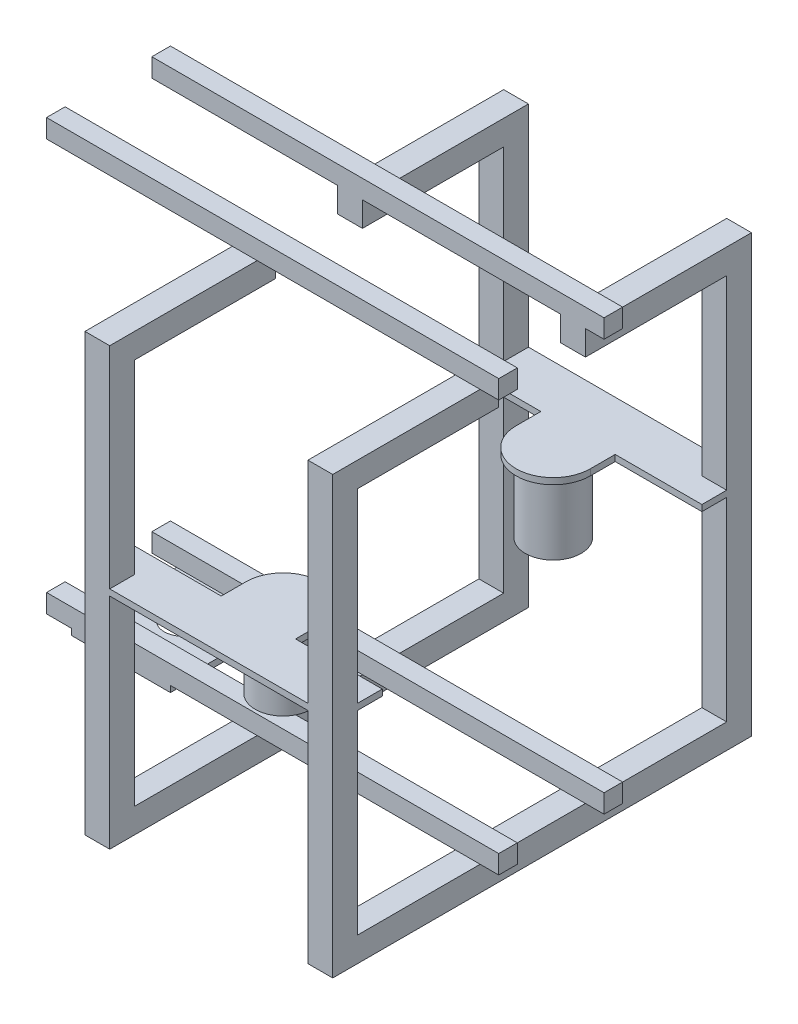
from build123d import *

# Parameters (mm, degrees)
SKETCH_1_W            = 20
SKETCH_1_H            = 338
EXTRUDE_1_DEPTH       = 20
EXTRUDE_1_2_DEPTH     = 20
SKETCH_2_W            = 20
SKETCH_2_H            = 20
EXTRUDE_2_DEPTH       = 157
EXTRUDE_4_DEPTH       = 5
SKETCH_6_R            = 22.5
EXTRUDE_5_DEPTH       = 58
EXTRUDE_6_DEPTH       = 15
EXTRUDE_6_DEPTH_BACK  = 350
SKETCH_7_W            = 15
SKETCH_7_H            = 15
SKETCH_12_W           = 20
SKETCH_12_H           = 20
EXTRUDE_10_DEPTH      = 150
SKETCH_13_W           = 20
SKETCH_13_H           = 20
EXTRUDE_11_DEPTH      = 134
SKETCH_14_W           = 20
SKETCH_14_H           = 20
EXTRUDE_12_DEPTH      = 134
EXTRUDE_13_DEPTH      = 15
EXTRUDE_13_DEPTH_BACK = 350
SKETCH_15_W           = 15
SKETCH_15_H           = 15
SKETCH_19_W           = 80
SKETCH_19_H           = 5
EXTRUDE_15_DEPTH      = 100
SKETCH_20_R           = 15
CUT_EXTRUDE_1_DEPTH   = 5


with BuildPart() as part:
    # 草图1 → 凸台-拉伸1 (new body)
    with BuildSketch(Plane(origin=(0, 0, 0), x_dir=(1, 0, 0), z_dir=(0, 1, 0))):
        with Locations((10, 169)):
            Rectangle(SKETCH_1_W, SKETCH_1_H)
    extrude(amount=EXTRUDE_1_DEPTH)



with BuildPart() as body_2:
    # 草图1 → Extrude 1 2 (new body)
    with BuildSketch(Plane(origin=(0, 0, 0), x_dir=(1, 0, 0), z_dir=(0, 1, 0))):
        with Locations((190, 169)):
            Rectangle(SKETCH_1_W, SKETCH_1_H)
    extrude(amount=EXTRUDE_1_2_DEPTH)


with BuildPart() as part_1:
    add(part.part)

    add(body_2.part)  # 凸台-拉伸2 merges body 2
    # 草图2 → 凸台-拉伸2 (add)
    with BuildSketch(Plane(origin=(0, 20, 0), x_dir=(1, 0, 0), z_dir=(0, 1, 0))):
        with Locations((10, 328)):
            Rectangle(SKETCH_2_W, SKETCH_2_H)
        with Locations((190, 328)):
            Rectangle(SKETCH_2_W, SKETCH_2_H)
        with Locations((190, 10)):
            Rectangle(SKETCH_2_W, SKETCH_2_H)
        with Locations((10, 10)):
            Rectangle(SKETCH_2_W, SKETCH_2_H)
    extrude(amount=EXTRUDE_2_DEPTH)

    # 草图5 → 凸台-拉伸4 (add)
    with BuildSketch(Plane(origin=(0, 177, 0), x_dir=(1, 0, 0), z_dir=(0, 1, 0))):
        with BuildLine():
            Line((0, 0), (200, 0))
            Line((200, 0), (200, 40))
            Line((200, 40), (130, 40))
            Line((130, 40), (130, 60))
            ThreePointArc((130, 60), (100, 90), (70, 60))
            Line((70, 60), (70, 40))
            Line((70, 40), (0, 40))
            Line((0, 40), (0, 0))
        make_face()
        with BuildLine():
            Line((0, 338), (200, 338))
            Line((200, 338), (200, 298))
            Line((200, 298), (130, 298))
            Line((130, 298), (130, 278))
            ThreePointArc((130, 278), (100, 248), (70, 278))
            Line((70, 278), (70, 298))
            Line((70, 298), (0, 298))
            Line((0, 298), (0, 338))
        make_face()
    extrude(amount=EXTRUDE_4_DEPTH)

    # 草图6 → 凸台-拉伸5 (add)
    with BuildSketch(Plane(origin=(0, 177, 0), x_dir=(-1, 0, 0), z_dir=(0, -1, 0))):
        with Locations((-100, 60)):
            Circle(SKETCH_6_R)
        with Locations((-100, 278)):
            Circle(SKETCH_6_R)
    extrude(amount=EXTRUDE_5_DEPTH)

    # 草图7 → 凸台-拉伸6 (add, two sides: drawn at the far end of the back side and taken through both)
    with BuildSketch(Plane(origin=(200, 0, 0), x_dir=(0, 0, -1), z_dir=(1, 0, 0)).offset(-EXTRUDE_6_DEPTH_BACK)):
        with Locations((126.5, 27.5)):
            Rectangle(SKETCH_7_W, SKETCH_7_H)
        with Locations((211.5, 27.5)):
            Rectangle(SKETCH_7_W, SKETCH_7_H)
    extrude(amount=EXTRUDE_6_DEPTH + EXTRUDE_6_DEPTH_BACK)

    # 草图12 → 凸台-拉伸10 (add)
    with BuildSketch(Plane(origin=(0, 182, 0), x_dir=(1, 0, 0), z_dir=(0, 1, 0))):
        with Locations((10, 328)):
            Rectangle(SKETCH_12_W, SKETCH_12_H)
        with Locations((190, 328)):
            Rectangle(SKETCH_12_W, SKETCH_12_H)
        with Locations((10, 10)):
            Rectangle(SKETCH_12_W, SKETCH_12_H)
        with Locations((190, 10)):
            Rectangle(SKETCH_12_W, SKETCH_12_H)
    extrude(amount=EXTRUDE_10_DEPTH)

    # 草图13 → 凸台-拉伸11 (add)
    with BuildSketch(Plane.XY):
        with Locations((190, 342)):
            Rectangle(SKETCH_13_W, SKETCH_13_H)
        with Locations((10, 342)):
            Rectangle(SKETCH_13_W, SKETCH_13_H)
    extrude(amount=-EXTRUDE_11_DEPTH)

    # 草图14 → 凸台-拉伸12 (add)
    with BuildSketch(Plane(origin=(0, 0, -338), x_dir=(-1, 0, 0), z_dir=(0, 0, -1))):
        with Locations((-190, 342)):
            Rectangle(SKETCH_14_W, SKETCH_14_H)
        with Locations((-10, 342)):
            Rectangle(SKETCH_14_W, SKETCH_14_H)
    extrude(amount=-EXTRUDE_12_DEPTH)

    # 草图15 → 凸台-拉伸13 (add, two sides: drawn at the far end of the back side and taken through both)
    with BuildSketch(Plane(origin=(200, 0, 0), x_dir=(0, 0, -1), z_dir=(1, 0, 0)).offset(-EXTRUDE_13_DEPTH_BACK)):
        with Locations((126.5, 359.5)):
            Rectangle(SKETCH_15_W, SKETCH_15_H)
        with Locations((211.5, 359.5)):
            Rectangle(SKETCH_15_W, SKETCH_15_H)
    extrude(amount=EXTRUDE_13_DEPTH + EXTRUDE_13_DEPTH_BACK)

    # 草图19 → 凸台-拉伸15 (add)
    with BuildSketch(Plane(origin=(0, 0, -219), x_dir=(-1, 0, 0), z_dir=(0, 0, -1))):
        with Locations((90, 17.5)):
            Rectangle(SKETCH_19_W, SKETCH_19_H)
    extrude(amount=-EXTRUDE_15_DEPTH)

    # 草图20 → 切除-拉伸1 (cut)
    with BuildSketch(Plane(origin=(0, 20, 0), x_dir=(1, 0, 0), z_dir=(0, 1, 0))):
        with Locations((-90, 169)):
            Circle(SKETCH_20_R)
    extrude(amount=-CUT_EXTRUDE_1_DEPTH, mode=Mode.SUBTRACT)


solid = part_1.part
